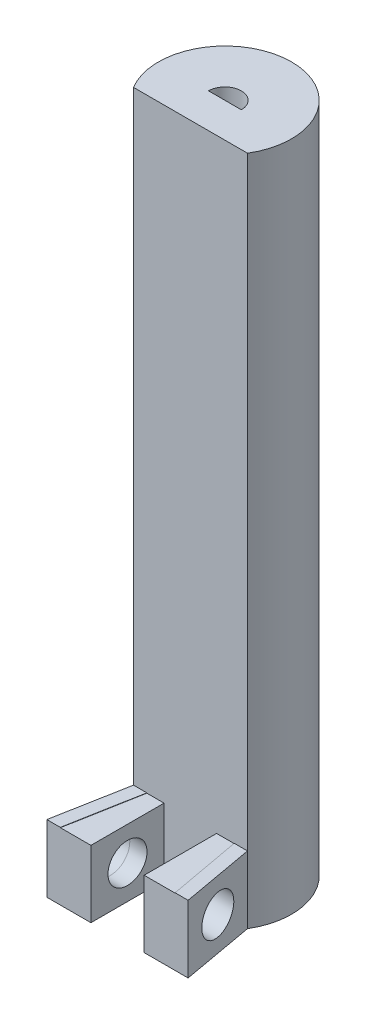
from build123d import *

# Parameters (mm, degrees)
SKETCH1_R           = 12.62515314
BOSS_EXTRUDE1_DEPTH = 127.254
SKETCH2_W           = 21.600890372
SKETCH2_H           = 6.08719661
CUT_EXTRUDE1_DEPTH  = 155.702
CUT_EXTRUDE2_DEPTH  = 141.081655767
BOSS_EXTRUDE2_DEPTH = 12.755190121
BOSS_EXTRUDE3_DEPTH = 12.755190121
BOSS_EXTRUDE4_DEPTH = 12.7
BOSS_EXTRUDE5_DEPTH = 12.7
SKETCH11_R          = 3.688999931
CUT_EXTRUDE3_DEPTH  = 13.97
SKETCH12_R          = 3.801462188
CUT_EXTRUDE4_DEPTH  = 11.43
SKETCH13_W          = 3.347443601
SKETCH13_H          = 13.720552831
BOSS_EXTRUDE6_DEPTH = 12.7
SKETCH14_W          = 3.264831583
SKETCH14_H          = 12.7
BOSS_EXTRUDE7_DEPTH = 13.97
SKETCH16_R          = 3.69446956
CUT_EXTRUDE6_DEPTH  = 45.212
SKETCH17_R          = 3.700235887
CUT_EXTRUDE7_DEPTH  = 28.702


with BuildPart() as part:
    # Sketch1 → Boss-Extrude1 (new body)
    with BuildSketch(Plane(origin=(0, 0, 0), x_dir=(1, 0, 0), z_dir=(0, 1, 0))):
        with Locations(Location((0, 0, 0), (0, 0, 270))):
            Circle(SKETCH1_R)
    extrude(amount=-BOSS_EXTRUDE1_DEPTH)

    # Sketch2 → Cut-Extrude1 (cut)
    with BuildSketch(Plane(origin=(0, -127.254, 0), x_dir=(-1, 0, 0), z_dir=(0, -1, 0))):
        with Locations((0, -9.581554835)):
            Rectangle(SKETCH2_W, SKETCH2_H)
    extrude(amount=-CUT_EXTRUDE1_DEPTH, mode=Mode.SUBTRACT)

    # Sketch3 → Cut-Extrude2 (cut)
    with BuildSketch(Plane(origin=(0, -127.254, 0), x_dir=(-1, 0, 0), z_dir=(0, -1, 0))):
        with BuildLine():
            Line((3.126169088, 0), (-3.091625783, 0))
            ThreePointArc((-3.091625783, 0), (0.017271652, 3.108897435), (3.126169088, 0))
        make_face()
    extrude(amount=-CUT_EXTRUDE2_DEPTH, mode=Mode.SUBTRACT)

    # Sketch4 → Boss-Extrude2 (add)
    with BuildSketch(Plane.XZ.offset(127.254)):
        Polygon((-10.800445186, 6.53795653), (-8.274777075, 6.53795653), (-10.800445186, 20.396051451), (-13.364649969, 20.396051451), align=None)
    extrude(amount=-BOSS_EXTRUDE2_DEPTH)

    # Sketch5 → Boss-Extrude3 (add)
    with BuildSketch(Plane.XZ.offset(127.254)):
        Polygon((10.800445186, 6.53795653), (8.287884941, 6.53795653), (10.800445186, 20.258509361), (13.265579683, 20.258509361), align=None)
    extrude(amount=-BOSS_EXTRUDE3_DEPTH)

    # Sketch9 → Boss-Extrude4 (add)
    with BuildSketch(Plane(origin=(0, -127.254, 0), x_dir=(-1, 0, 0), z_dir=(0, -1, 0))):
        Polygon((10.800445186, -20.396051451), (8.274777075, -20.396051451), (8.274777075, -6.53795653), align=None)
    extrude(amount=-BOSS_EXTRUDE4_DEPTH)

    # Sketch10 → Boss-Extrude5 (add)
    with BuildSketch(Plane(origin=(0, -127.254, 0), x_dir=(-1, 0, 0), z_dir=(0, -1, 0))):
        Polygon((-8.287884941, -6.53795653), (-8.287884941, -20.258509361), (-10.800445186, -20.258509361), align=None)
    extrude(amount=-BOSS_EXTRUDE5_DEPTH)

    # Sketch11 → Cut-Extrude3 (cut)
    with BuildSketch(Plane.ZY.offset(-8.287884941)):
        with Locations((13.398232945, -120.904)):
            Circle(SKETCH11_R)
    extrude(amount=-CUT_EXTRUDE3_DEPTH, mode=Mode.SUBTRACT)

    # Sketch12 → Cut-Extrude4 (cut)
    with BuildSketch(Plane(origin=(-8.274777075, 0, 0), x_dir=(0, 0, -1), z_dir=(1, 0, 0))):
        with Locations((-13.46700399, -120.904)):
            Circle(SKETCH12_R)
    extrude(amount=-CUT_EXTRUDE4_DEPTH, mode=Mode.SUBTRACT)

    # Sketch13 → Boss-Extrude6 (add)
    with BuildSketch(Plane.XZ.offset(127.254)):
        with Locations((6.614163141, 13.398232946)):
            Rectangle(SKETCH13_W, SKETCH13_H)
    extrude(amount=-BOSS_EXTRUDE6_DEPTH)

    # Sketch14 → Boss-Extrude7 (add)
    with BuildSketch(Plane.XY.offset(20.396051451)):
        with Locations((-6.642361284, -120.904)):
            Rectangle(SKETCH14_W, SKETCH14_H)
    extrude(amount=-BOSS_EXTRUDE7_DEPTH)

    # Sketch16 → Cut-Extrude6 (cut)
    with BuildSketch(Plane.ZY.offset(-4.94044134)):
        with Locations((13.398232945, -120.904)):
            Circle(SKETCH16_R)
    extrude(amount=-CUT_EXTRUDE6_DEPTH, mode=Mode.SUBTRACT)

    # Sketch17 → Cut-Extrude7 (cut)
    with BuildSketch(Plane(origin=(-5.009945492, 0, 0), x_dir=(0, 0, -1), z_dir=(1, 0, 0))):
        with Locations((-13.46700399, -120.904)):
            Circle(SKETCH17_R)
    extrude(amount=-CUT_EXTRUDE7_DEPTH, mode=Mode.SUBTRACT)


solid = part.part
